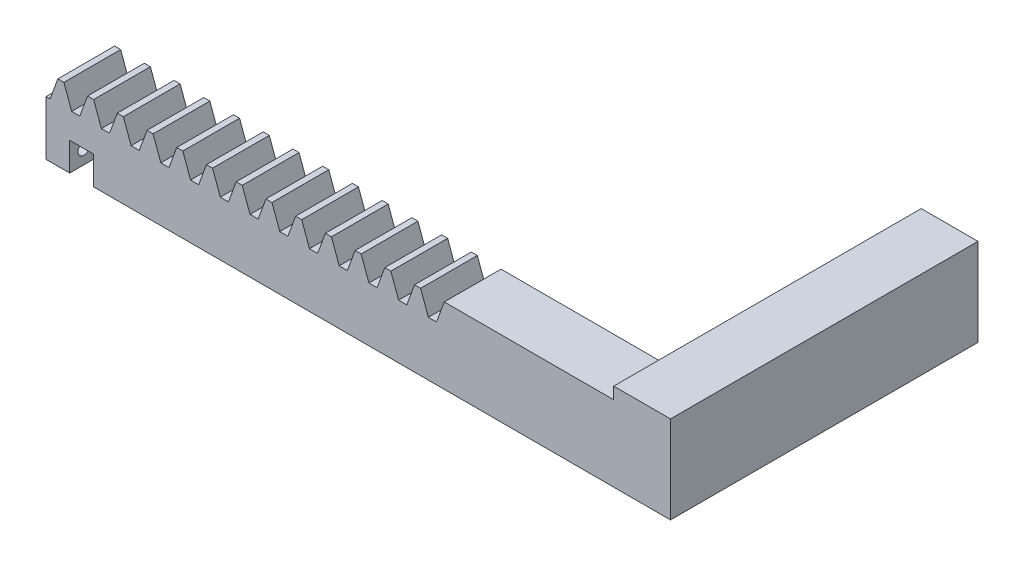
from build123d import *

# Parameters (mm, degrees)
BOSS_EXTRUDE1_DEPTH = 12
SKETCH6_W           = 12
SKETCH6_H           = 11.5
BOSS_EXTRUDE4_DEPTH = 65
SKETCH7_W           = 12
SKETCH7_H           = 7
BOSS_EXTRUDE5_DEPTH = 65
SKETCH8_W           = 5
SKETCH8_H           = 6
CUT_EXTRUDE1_DEPTH  = 65
SKETCH9_W           = 34.920803936
SKETCH9_H           = 4.5
BOSS_EXTRUDE6_DEPTH = 12
SKETCH10_R          = 1.25
CUT_EXTRUDE2_DEPTH  = 12


with BuildPart() as part:
    # Sketch1 → Boss-Extrude1 (new body)
    with BuildSketch(Plane(origin=(0, 0, -6), x_dir=(-1, 0, 0), z_dir=(0, 0, -1))):
        Polygon((-70.736133614, 14.634553049), (-72.373999668, 10.134553049), (-73.855349707, 10.134553049), (-73.855349707, -1.365446951), (46.144650293, -1.365446951), (46.144650293, 10.134553049), (45.282779553, 10.134553049), (43.644913499, 14.634553049), (42.361201786, 14.634553049), (40.723335732, 10.134553049), (38.999594253, 10.134553049), (37.361728199, 14.634553049), (36.078016486, 14.634553049), (34.440150432, 10.134553049), (32.716408953, 10.134553049), (31.078542899, 14.634553049), (29.794831186, 14.634553049), (28.156965132, 10.134553049), (26.433223653, 10.134553049), (24.795357599, 14.634553049), (23.511645886, 14.634553049), (21.873779832, 10.134553049), (20.150038353, 10.134553049), (18.512172299, 14.634553049), (17.228460586, 14.634553049), (15.590594532, 10.134553049), (13.866853053, 10.134553049), (12.228986999, 14.634553049), (10.945275286, 14.634553049), (9.307409232, 10.134553049), (7.583667753, 10.134553049), (5.945801699, 14.634553049), (4.662089986, 14.634553049), (3.024223932, 10.134553049), (1.300482453, 10.134553049), (-0.337383601, 14.634553049), (-1.621095314, 14.634553049), (-3.258961368, 10.134553049), (-4.982702847, 10.134553049), (-6.620568901, 14.634553049), (-7.904280614, 14.634553049), (-9.542146668, 10.134553049), (-11.265888147, 10.134553049), (-12.903754201, 14.634553049), (-14.187465914, 14.634553049), (-15.825331968, 10.134553049), (-17.549073447, 10.134553049), (-19.186939501, 14.634553049), (-20.470651214, 14.634553049), (-22.108517268, 10.134553049), (-23.832258747, 10.134553049), (-25.470124801, 14.634553049), (-26.753836514, 14.634553049), (-28.391702568, 10.134553049), (-30.115444047, 10.134553049), (-31.753310101, 14.634553049), (-33.037021814, 14.634553049), (-34.674887868, 10.134553049), (-36.398629347, 10.134553049), (-38.036495401, 14.634553049), (-39.320207114, 14.634553049), (-40.958073168, 10.134553049), (-42.681814647, 10.134553049), (-44.319680701, 14.634553049), (-45.603392414, 14.634553049), (-47.241258468, 10.134553049), (-48.964999947, 10.134553049), (-50.602866001, 14.634553049), (-51.886577714, 14.634553049), (-53.524443768, 10.134553049), (-55.248185247, 10.134553049), (-56.886051301, 14.634553049), (-58.169763014, 14.634553049), (-59.807629068, 10.134553049), (-61.531370547, 10.134553049), (-63.169236601, 14.634553049), (-64.452948314, 14.634553049), (-66.090814368, 10.134553049), (-67.814555847, 10.134553049), (-69.452421901, 14.634553049), align=None)
    extrude(amount=-BOSS_EXTRUDE1_DEPTH)

    # Sketch6 → Boss-Extrude4 (add)
    with BuildSketch(Plane.XY.offset(6)):
        with Locations((79.855349707, 4.384553049)):
            Rectangle(SKETCH6_W, SKETCH6_H)
    extrude(amount=-BOSS_EXTRUDE4_DEPTH)

    # Sketch7 → Boss-Extrude5 (add)
    with BuildSketch(Plane.XY.offset(6)):
        with Locations((79.855349707, 13.634553049)):
            Rectangle(SKETCH7_W, SKETCH7_H)
    extrude(amount=-BOSS_EXTRUDE5_DEPTH)

    # Sketch8 → Cut-Extrude1 (cut)
    with BuildSketch(Plane.XY.offset(6)):
        with Locations((-38.644650293, 1.634553049)):
            Rectangle(SKETCH8_W, SKETCH8_H)
    extrude(amount=-CUT_EXTRUDE1_DEPTH, mode=Mode.SUBTRACT)

    # Sketch9 → Boss-Extrude6 (add)
    with BuildSketch(Plane.XY.offset(6)):
        with Locations((56.394947739, 12.384553049)):
            Rectangle(SKETCH9_W, SKETCH9_H)
    extrude(amount=-BOSS_EXTRUDE6_DEPTH)

    # Sketch10 → Cut-Extrude2 (cut)
    with BuildSketch(Plane.ZY.offset(46.144650293)):
        with Locations((-3, 1.634553049)):
            Circle(SKETCH10_R)
        with Locations((3, 1.634553049)):
            Circle(SKETCH10_R)
    extrude(amount=-CUT_EXTRUDE2_DEPTH, mode=Mode.SUBTRACT)


solid = part.part
